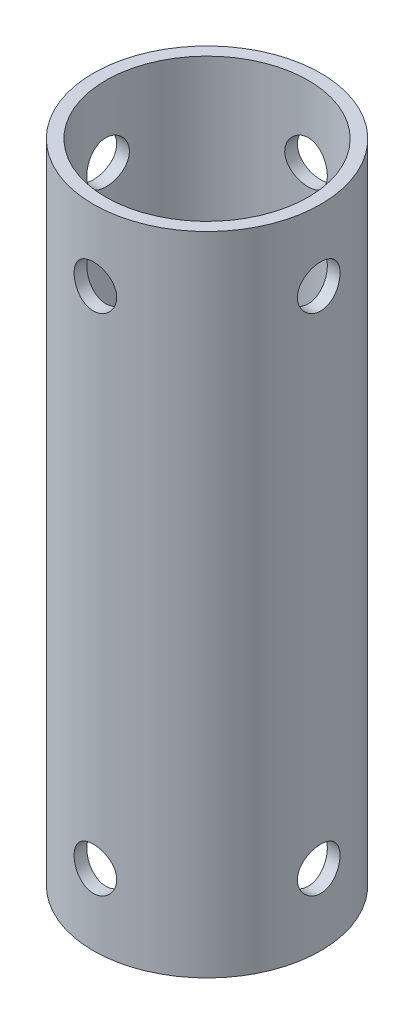
from build123d import *

# Parameters (mm, degrees)
SKETCH1_R           = 16
SKETCH1_R_2         = 14.25
BOSS_EXTRUDE1_DEPTH = 91
SKETCH2_R           = 3
CUT_EXTRUDE1_DEPTH  = 10
CIRPATTERN1_COUNT   = 4


with BuildPart() as part:
    # Sketch1 → Boss-Extrude1 (new body)
    with BuildSketch(Plane(origin=(0, 0, 0), x_dir=(1, 0, 0), z_dir=(0, 1, 0))):
        with Locations(Location((0, 0, 0), (0, 0, 270))):
            Circle(SKETCH1_R)
        with Locations(Location((0, 0, 0), (0, 0, 270))):
            Circle(SKETCH1_R_2, mode=Mode.SUBTRACT)
    extrude(amount=BOSS_EXTRUDE1_DEPTH)

    # Sketch2 → Cut-Extrude1 (cut)
    with BuildSketch(Plane(origin=(0, 0, -16), x_dir=(-1, 0, 0), z_dir=(0, 0, -1))):
        with Locations(Location((0, 10, 0), (0, 0, 90))):
            Circle(SKETCH2_R)
        with Locations(Location((0, 81, 0), (0, 0, 90))):
            Circle(SKETCH2_R)
    cut_extrude1 = extrude(amount=-CUT_EXTRUDE1_DEPTH, mode=Mode.SUBTRACT)

    # CirPattern1: Cut-Extrude1 ×4 about axis
    cirpattern1_axis = Axis((0, 91, 0), (0, -1, 0))
    for i in range(1, CIRPATTERN1_COUNT):
        add(cut_extrude1.rotate(cirpattern1_axis, i * 360 / CIRPATTERN1_COUNT), mode=Mode.SUBTRACT)


solid = part.part
